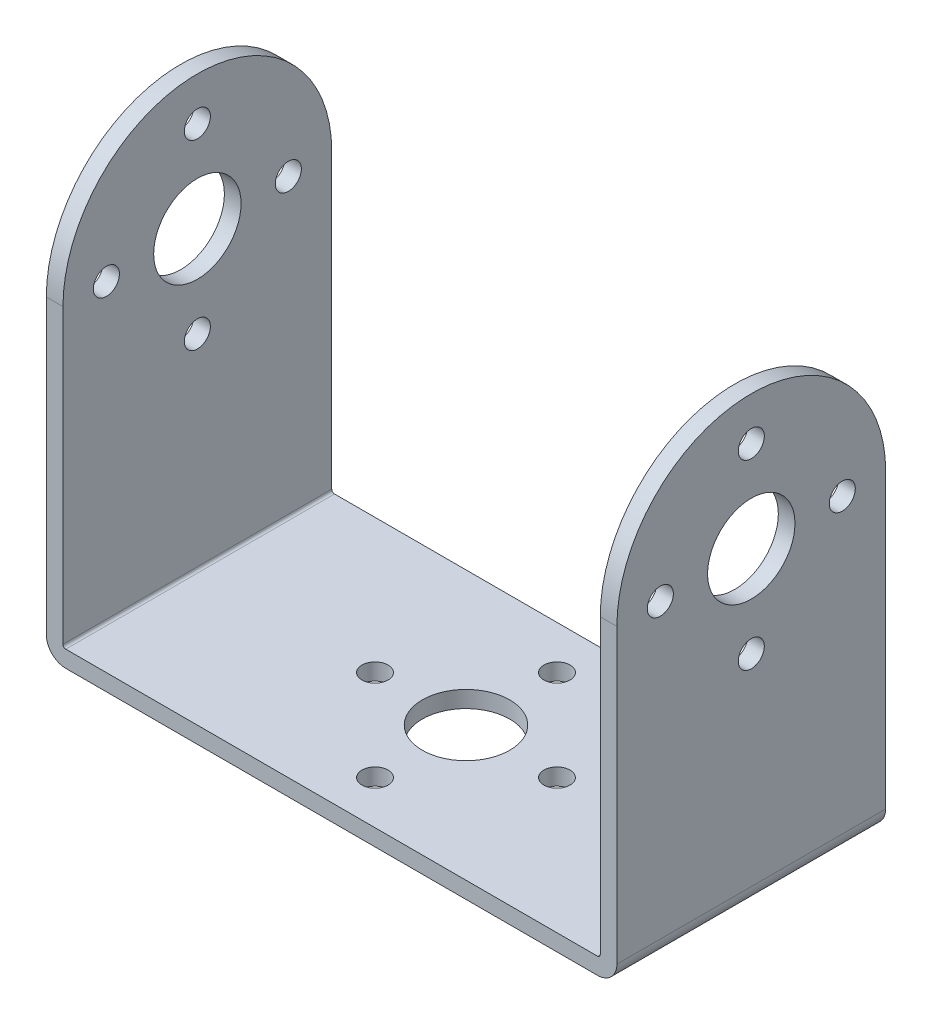
from build123d import *

# Parameters (mm, degrees)
SKETCH1_W               = 49.1998
SKETCH1_H               = 24.6126
SKETCH1_R               = 1.1938
SKETCH1_R_2             = 4.0005
EXTRUDE1_DEPTH          = 1.524
SKETCH1_3_W             = 1.524
SKETCH1_3_H             = 24.6126
EXTRUDE2_DEPTH          = 40.8686
CUT_EXTRUDE1_DEPTH      = 40.8686
CUT_EXTRUDE1_DEPTH_BACK = 40.8686
SKETCH4_R               = 4.0005
SKETCH4_R_2             = 1.1938
FILLET1_R               = 0.254
FILLET2_R               = 1.778


with BuildPart() as part:
    # Sketch1 → Extrude1 (new body)
    with BuildSketch(Plane(origin=(0, 0, 0), x_dir=(1, 0, 0), z_dir=(0, 1, 0))):
        Rectangle(SKETCH1_W, SKETCH1_H)
        with Locations(Location((-8.3312, 0, 0), (0, 0, 90))):
            Circle(SKETCH1_R, mode=Mode.SUBTRACT)
        with Locations(Location((0, -8.3312, 0), (0, 0, 90))):
            Circle(SKETCH1_R, mode=Mode.SUBTRACT)
        with Locations(Location((0, 0, 0), (0, 0, 90))):
            Circle(SKETCH1_R_2, mode=Mode.SUBTRACT)
        with Locations(Location((8.3312, 0, 0), (0, 0, 90))):
            Circle(SKETCH1_R, mode=Mode.SUBTRACT)
        with Locations(Location((0, 8.3312, 0), (0, 0, 90))):
            Circle(SKETCH1_R, mode=Mode.SUBTRACT)
    extrude(amount=EXTRUDE1_DEPTH)

    # Sketch1<3> → Extrude2 (add)
    with BuildSketch(Plane(origin=(0, 0, 0), x_dir=(1, 0, 0), z_dir=(0, 1, 0))):
        with Locations((25.3619, 0)):
            Rectangle(SKETCH1_3_W, SKETCH1_3_H)
        with Locations((-25.3619, 0)):
            Rectangle(SKETCH1_3_W, SKETCH1_3_H)
    extrude(amount=EXTRUDE2_DEPTH)

    # Sketch4 → Cut-Extrude1 (cut, two sides: drawn at the far end of the back side and taken through both)
    with BuildSketch(Plane(origin=(0, 0, 0), x_dir=(0, 0, -1), z_dir=(1, 0, 0)).offset(-CUT_EXTRUDE1_DEPTH_BACK)):
        with BuildLine():
            Line((0, 40.8686), (-12.3063, 40.8686))
            Line((-12.3063, 40.8686), (-12.3063, 28.5623))
            ThreePointArc((-12.3063, 28.5623), (-8.701868181, 37.264168181), (0, 40.8686))
        make_face()
        with BuildLine():
            Line((12.3063, 40.8686), (0, 40.8686))
            ThreePointArc((0, 40.8686), (8.701868181, 37.264168181), (12.3063, 28.5623))
            Line((12.3063, 28.5623), (12.3063, 40.8686))
        make_face()
        with Locations((0, 28.575)):
            Circle(SKETCH4_R)
        with Locations((8.3312, 28.575)):
            Circle(SKETCH4_R_2)
        with Locations((0, 36.9062)):
            Circle(SKETCH4_R_2)
        with Locations((-8.3312, 28.575)):
            Circle(SKETCH4_R_2)
        with Locations((0, 20.2438)):
            Circle(SKETCH4_R_2)
    extrude(amount=CUT_EXTRUDE1_DEPTH + CUT_EXTRUDE1_DEPTH_BACK, mode=Mode.SUBTRACT)

    # Fillet1
    fillet1_edges = [part.edges().sort_by_distance(p)[0] for p in [
        (-24.5999, 1.524, 0),
        (24.5999, 1.524, 0),
    ]]
    fillet(fillet1_edges, radius=FILLET1_R)

    # Fillet2
    fillet2_edges = [part.edges().sort_by_distance(p)[0] for p in [
        (-26.1239, 0, 0),
        (26.1239, 0, 0),
    ]]
    fillet(fillet2_edges, radius=FILLET2_R)


solid = part.part
